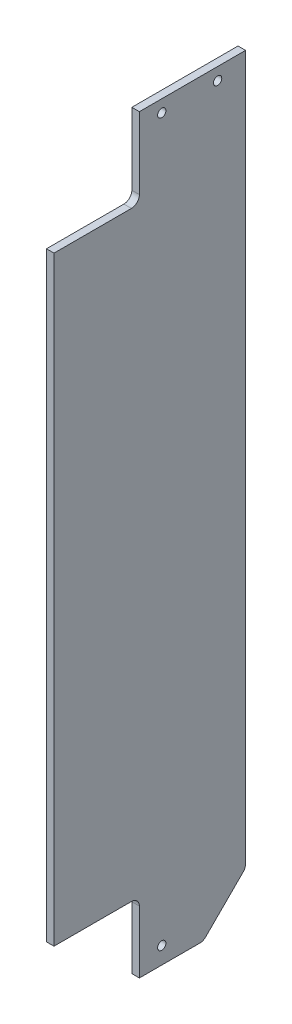
from build123d import *

# Parameters (mm, degrees)
SKETCH1_R           = 1.65
BOSS_EXTRUDE1_DEPTH = 3
FILLET1_R           = 3.175


with BuildPart() as part:
    # Sketch1 → Boss-Extrude1 (new body)
    with BuildSketch(Plane(origin=(0, 0, 0), x_dir=(0, 0, -1), z_dir=(1, 0, 0))):
        Polygon((-15.875, 0), (18.0975, 0), (18.0975, 31.75), (60.325, 31.75), (60.325, -249.8725), (43.4975, -266.7), (18.0975, -266.7), (18.0975, -238.76), (-15.875, -238.76), align=None)
        with Locations((26.9875, 26.8732)):
            Circle(SKETCH1_R, mode=Mode.SUBTRACT)
        with Locations((49.2125, 26.8732)):
            Circle(SKETCH1_R, mode=Mode.SUBTRACT)
        with Locations(Location((26.9875, -259.9563, 0), (0, 0, 180))):
            Circle(SKETCH1_R, mode=Mode.SUBTRACT)
    extrude(amount=BOSS_EXTRUDE1_DEPTH)

    # Fillet1
    fillet1_edges = [part.edges().sort_by_distance(p)[0] for p in [
        (1.5, 0, -18.0975),
        (1.5, -249.8725, -60.325),
        (1.5, -266.7, -43.4975),
        (1.5, -238.76, -18.0975),
    ]]
    fillet(fillet1_edges, radius=FILLET1_R)


solid = part.part
